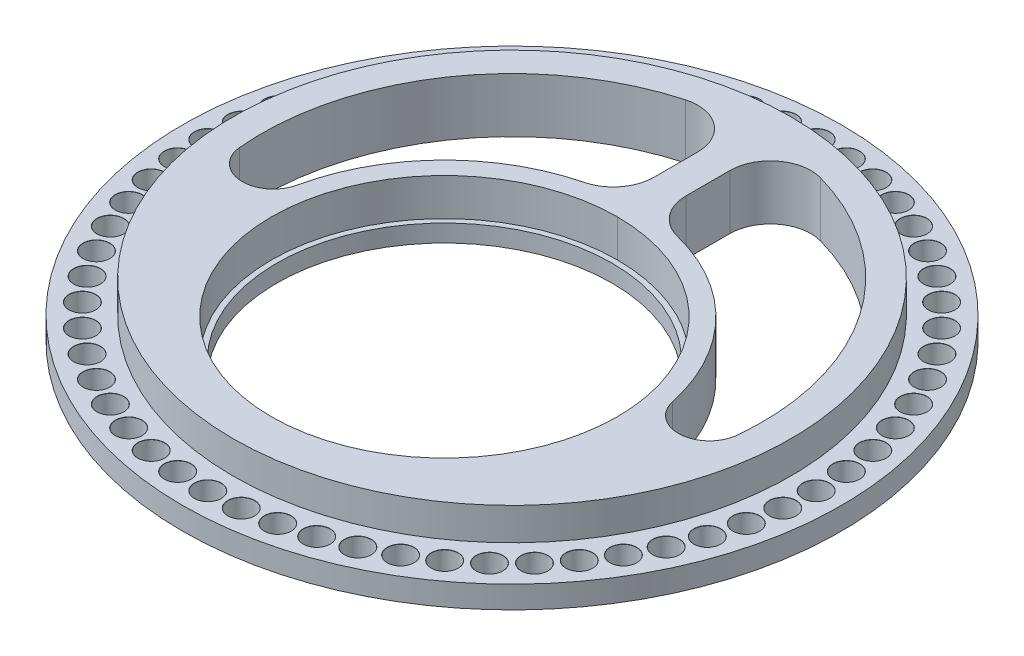
from build123d import *

# Parameters (mm, degrees)
SKETCH1_R                  = 61.9125
SKETCH1_R_2                = 30.988
SLOTTED_BODY_EXTRUDE_DEPTH = 4.191
SKETCH5_R                  = 52.3875
BOSS_EXTRUDE3_DEPTH        = 6.080000032
SKETCH6_R                  = 32.512
CUT_EXTRUDE5_DEPTH         = 89.157862691
SKETCH8_R                  = 32.512
SKETCH8_R_2                = 31.496
BOSS_EXTRUDE4_DEPTH        = 3.255000094
CIRPATTERN1_COUNT          = 60


with BuildPart() as part:
    # Sketch1 → Slotted-Body Extrude (new body)
    with BuildSketch(Plane(origin=(0, 0, 0), x_dir=(1, 0, 0), z_dir=(0, 1, 0))):
        with Locations(Location((0, 0, 0), (0, 0, 270))):
            Circle(SKETCH1_R)
        with Locations(Location((0, -12.7, 0), (0, 0, 270))):
            Circle(SKETCH1_R_2, mode=Mode.SUBTRACT)
    extrude(amount=SLOTTED_BODY_EXTRUDE_DEPTH)

    # Sketch5 → Boss-Extrude3 (add)
    with BuildSketch(Plane(origin=(0, 4.191, 0), x_dir=(1, 0, 0), z_dir=(0, 1, 0))):
        with Locations(Location((0, 0, 0), (0, 0, 270))):
            Circle(SKETCH5_R)
    extrude(amount=BOSS_EXTRUDE3_DEPTH)

    # Sketch6 → Cut-Extrude5 (cut, through all)
    with BuildSketch(Plane.XZ):
        with Locations(Location((0, 12.7, 0), (0, 0, 270))):
            Circle(SKETCH6_R)
        with BuildLine():
            Line((-3.013951015, -37.906674687), (-3.013951015, -29.674053734))
            ThreePointArc((-3.013951015, -29.674053734), (-4.62572071, -24.987309811), (-8.779192117, -22.283230408))
            ThreePointArc((-8.779192117, -22.283230408), (-25.925135322, -12.375645206), (-35.256203169, 5.09074497))
            ThreePointArc((-35.256203169, 5.09074497), (-41.313127715, 9.689980346), (-46.782976949, 4.406037654))
            ThreePointArc((-46.782976949, 4.406037654), (-38.737451576, -26.59830719), (-12.692135082, -45.243450433))
            ThreePointArc((-12.692135082, -45.243450433), (-6.03063496, -43.979061474), (-3.013951015, -37.906674687))
        make_face()
        with BuildLine():
            Line((3.013951015, -37.906674687), (3.013951015, -29.674053734))
            ThreePointArc((3.013951015, -29.674053734), (4.62572071, -24.987309811), (8.779192117, -22.283230408))
            ThreePointArc((8.779192117, -22.283230408), (25.925135322, -12.375645206), (35.256203169, 5.09074497))
            ThreePointArc((35.256203169, 5.09074497), (41.313127715, 9.689980346), (46.782976949, 4.406037654))
            ThreePointArc((46.782976949, 4.406037654), (38.737451576, -26.59830719), (12.692135082, -45.243450433))
            ThreePointArc((12.692135082, -45.243450433), (6.03063496, -43.979061474), (3.013951015, -37.906674687))
        make_face()
    extrude(amount=-CUT_EXTRUDE5_DEPTH, mode=Mode.SUBTRACT)

    # Sketch10 → Ø5.0mm Dowel Hole1 (revolve, cut)
    with BuildSketch(Plane(origin=(0, 4.191, -57.15), x_dir=(0, 0, 1), z_dir=(1, 0, 0))):
        Polygon((0, 0), (0, 4.191), (2.5, 4.191), (2.5, 0.025), (2.525, 0), align=None)
    f_5_0mm_dowel_hole1 = revolve(axis=Axis((0, 10.541, -57.15), (0, -1, 0)), mode=Mode.SUBTRACT)

    # CirPattern1: Ø5.0mm Dowel Hole1 ×60 about axis
    cirpattern1_axis = Axis((0, 0, 0), (0, 1, 0))
    for i in range(1, CIRPATTERN1_COUNT):
        add(f_5_0mm_dowel_hole1.rotate(cirpattern1_axis, i * 360 / CIRPATTERN1_COUNT), mode=Mode.SUBTRACT)


with BuildPart() as body_2:
    # Sketch8 → Boss-Extrude4 (new body)
    with BuildSketch(Plane.XZ):
        with Locations(Location((0, 12.7, 0), (0, 0, 270))):
            Circle(SKETCH8_R)
        with Locations(Location((0, 12.7, 0), (0, 0, 270))):
            Circle(SKETCH8_R_2, mode=Mode.SUBTRACT)
    extrude(amount=-BOSS_EXTRUDE4_DEPTH)


solid = Compound([part.part, body_2.part])
